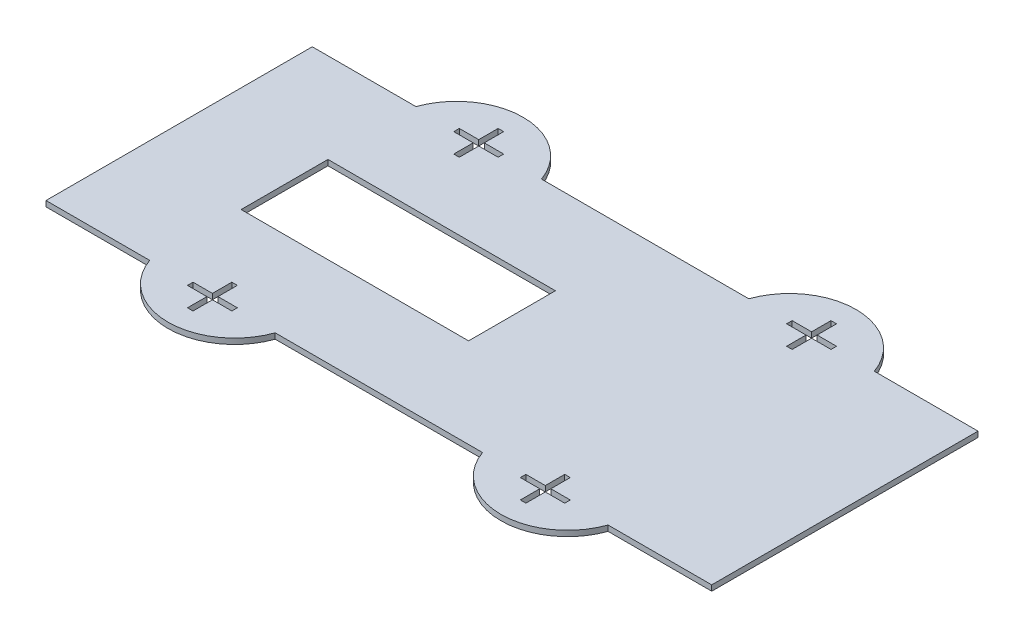
from build123d import *

# Parameters (mm, degrees)
BOSS_EXTRUDE2_DEPTH = 3.175
SKETCH2_W           = 130.175
SKETCH2_H           = 5
CUT_EXTRUDE1_DEPTH  = 10


with BuildPart() as part:
    # Sketch1 → Boss-Extrude2 (new body)
    with BuildSketch(Plane(origin=(0, 0, 0), x_dir=(1, 0, 0), z_dir=(0, 1, 0))):
        with BuildLine():
            ThreePointArc((81.740740222, -99.802389706), (117.661764706, -125.202389706), (153.58278919, -99.802389706))
            Line((153.58278919, -99.802389706), (212.911764706, -99.802389706))
            Line((212.911764706, -99.802389706), (212.911764706, 52.597610294))
            Line((212.911764706, 52.597610294), (153.58278919, 52.597610294))
            ThreePointArc((153.58278919, 52.597610294), (117.661764706, 77.997610294), (81.740740222, 52.597610294))
            Line((81.740740222, 52.597610294), (-36.91721081, 52.597610294))
            ThreePointArc((-36.91721081, 52.597610294), (-72.838235294, 77.997610294), (-108.759259778, 52.597610294))
            Line((-108.759259778, 52.597610294), (-168.088235294, 52.597610294))
            Line((-168.088235294, 52.597610294), (-168.088235294, -23.602389706))
            Line((-168.088235294, -23.602389706), (-168.088235294, -99.802389706))
            Line((-168.088235294, -99.802389706), (-108.759259778, -99.802389706))
            ThreePointArc((-108.759259778, -99.802389706), (-72.838235294, -125.202389706), (-36.91721081, -99.802389706))
            Line((-36.91721081, -99.802389706), (81.740740222, -99.802389706))
        make_face()
        Polygon((-74.425735294, -87.102389706), (-71.250735294, -87.102389706), (-71.250735294, -98.214889706), (-60.138235294, -98.214889706), (-60.138235294, -101.389889706), (-71.250735294, -101.389889706), (-71.250735294, -112.502389706), (-74.425735294, -112.502389706), (-74.425735294, -101.389889706), (-85.538235294, -101.389889706), (-85.538235294, -98.214889706), (-74.425735294, -98.214889706), align=None, mode=Mode.SUBTRACT)
        Polygon((116.074264706, -87.102389706), (119.249264706, -87.102389706), (119.249264706, -98.214889706), (130.361764706, -98.214889706), (130.361764706, -101.389889706), (119.249264706, -101.389889706), (119.249264706, -112.502389706), (116.074264706, -112.502389706), (116.074264706, -101.389889706), (104.961764706, -101.389889706), (104.961764706, -98.214889706), (116.074264706, -98.214889706), align=None, mode=Mode.SUBTRACT)
        Polygon((-107.763235294, -43.446189706), (-107.763235294, -23.602389706), (-107.763235294, -3.758589706), (22.411764706, -3.758589706), (22.411764706, -43.446189706), align=None, mode=Mode.SUBTRACT)
        Polygon((-60.138235294, 54.185110294), (-60.138235294, 51.010110294), (-71.250735294, 51.010110294), (-71.250735294, 39.897610294), (-74.425735294, 39.897610294), (-74.425735294, 51.010110294), (-85.538235294, 51.010110294), (-85.538235294, 54.185110294), (-74.425735294, 54.185110294), (-74.425735294, 65.297610294), (-71.250735294, 65.297610294), (-71.250735294, 54.185110294), align=None, mode=Mode.SUBTRACT)
        Polygon((130.361764706, 54.185110294), (130.361764706, 51.010110294), (119.249264706, 51.010110294), (119.249264706, 39.897610294), (116.074264706, 39.897610294), (116.074264706, 51.010110294), (104.961764706, 51.010110294), (104.961764706, 54.185110294), (116.074264706, 54.185110294), (116.074264706, 65.297610294), (119.249264706, 65.297610294), (119.249264706, 54.185110294), align=None, mode=Mode.SUBTRACT)
    extrude(amount=BOSS_EXTRUDE2_DEPTH)

    # Sketch2 → Cut-Extrude1 (cut)
    with BuildSketch(Plane(origin=(0, 3.175, 0), x_dir=(1, 0, 0), z_dir=(0, 1, 0))):
        with Locations((-42.675735294, -45.946189706)):
            Rectangle(SKETCH2_W, SKETCH2_H)
        with Locations((-42.675735294, -1.258589706)):
            Rectangle(SKETCH2_W, SKETCH2_H)
    extrude(amount=-CUT_EXTRUDE1_DEPTH, mode=Mode.SUBTRACT)


solid = part.part
